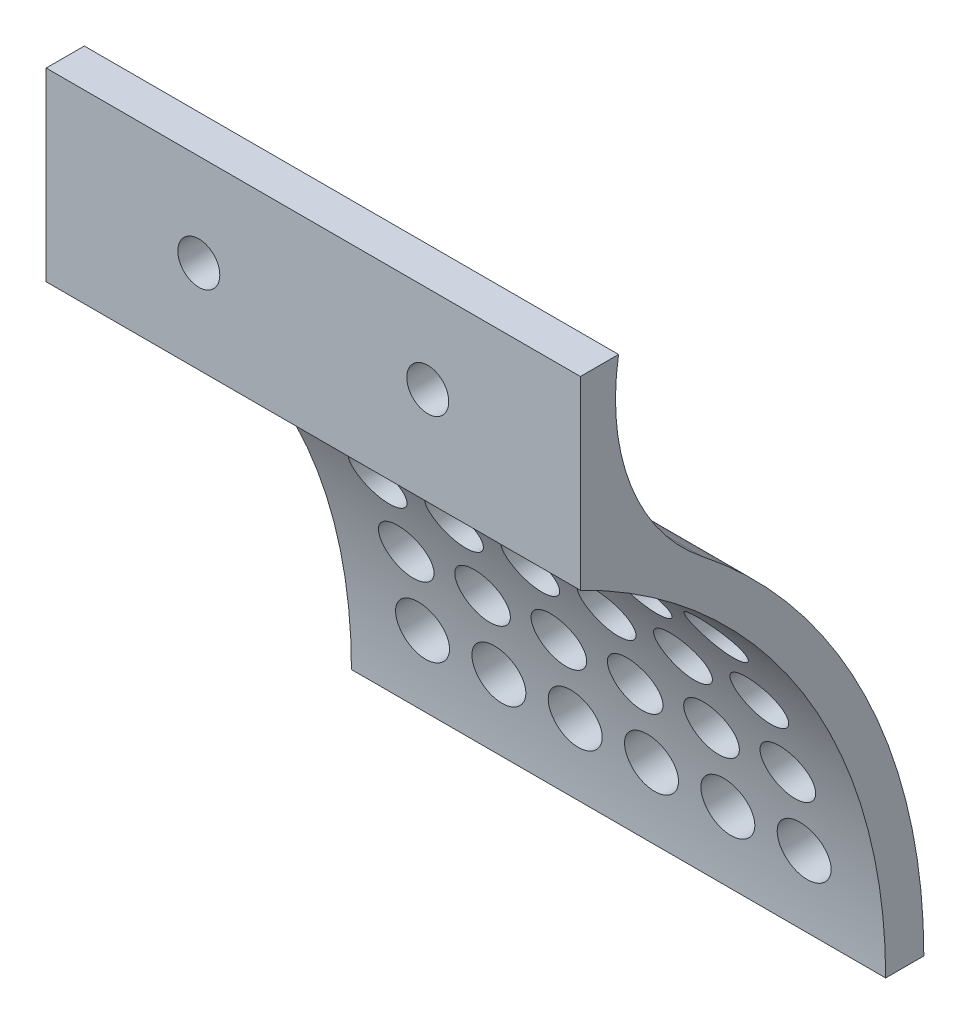
from build123d import *

# Parameters (mm, degrees)
SALIENTE_EXTRUIR1_DEPTH = 70
CROQUIS3_R              = 3.5
CORTAR_EXTRUIR3_DEPTH   = 65
CROQUIS2_R              = 2.750000002
CROQUIS2_R_2            = 2.75
CORTAR_EXTRUIR4_DEPTH   = 65


with BuildPart() as part:
    # Croquis1 → Saliente-Extruir1 (new body)
    with BuildSketch(Plane(origin=(0, 0, 0), x_dir=(0, 0, -1), z_dir=(1, 0, 0))):
        with BuildLine():
            Line((-25.193840863, 53.195024044), (-20.193840863, 53.195024044))
            ThreePointArc((-20.193840863, 53.195024044), (-18.573108699, 37.469004774), (-9.183016609, 24.750489713))
            ThreePointArc((-9.183016609, 24.750489713), (12.176943033, -1.828536951), (19.806159137, -35.062369049))
            Line((19.806159137, -35.062369049), (14.806159137, -35.062369049))
            ThreePointArc((14.806159137, -35.062369049), (3.983638383, 2.673555479), (-25.193840863, 28.937630951))
            Line((-25.193840863, 28.937630951), (-25.193840863, 53.195024044))
        make_face()
    extrude(amount=SALIENTE_EXTRUIR1_DEPTH)

    # Croquis3 → Cortar-Extruir3 (cut)
    with BuildSketch(Plane.XY.offset(-19.806159137)):
        with Locations(Location((60, 14.750489713, 0), (0, 0, 180))):
            Circle(CROQUIS3_R)
        with Locations(Location((50, 14.750489713, 0), (0, 0, 180))):
            Circle(CROQUIS3_R)
        with Locations(Location((40, 14.750489713, 0), (0, 0, 180))):
            Circle(CROQUIS3_R)
        with Locations(Location((30, 14.750489713, 0), (0, 0, 180))):
            Circle(CROQUIS3_R)
        with Locations(Location((20, 14.750489713, 0), (0, 0, 180))):
            Circle(CROQUIS3_R)
        with Locations(Location((10, 14.750489713, 0), (0, 0, 180))):
            Circle(CROQUIS3_R)
        with Locations(Location((50, 4.750489713, 0), (0, 0, 180))):
            Circle(CROQUIS3_R)
        with Locations(Location((40, 4.750489713, 0), (0, 0, 180))):
            Circle(CROQUIS3_R)
        with Locations(Location((30, 4.750489713, 0), (0, 0, 180))):
            Circle(CROQUIS3_R)
        with Locations(Location((20, 4.750489713, 0), (0, 0, 180))):
            Circle(CROQUIS3_R)
        with Locations(Location((10, 4.750489713, 0), (0, 0, 180))):
            Circle(CROQUIS3_R)
        with Locations(Location((50, -5.249510287, 0), (0, 0, 180))):
            Circle(CROQUIS3_R)
        with Locations(Location((40, -5.249510287, 0), (0, 0, 180))):
            Circle(CROQUIS3_R)
        with Locations(Location((30, -5.249510287, 0), (0, 0, 180))):
            Circle(CROQUIS3_R)
        with Locations(Location((20, -5.249510287, 0), (0, 0, 180))):
            Circle(CROQUIS3_R)
        with Locations(Location((10, -5.249510287, 0), (0, 0, 180))):
            Circle(CROQUIS3_R)
        with Locations(Location((60, 4.750489713, 0), (0, 0, 180))):
            Circle(CROQUIS3_R)
        with Locations(Location((60, -5.249510287, 0), (0, 0, 180))):
            Circle(CROQUIS3_R)
        with Locations(Location((20, -15.249510287, 0), (0, 0, 180))):
            Circle(CROQUIS3_R)
        with Locations(Location((30, -15.249510287, 0), (0, 0, 180))):
            Circle(CROQUIS3_R)
        with Locations(Location((40, -15.249510287, 0), (0, 0, 180))):
            Circle(CROQUIS3_R)
        with Locations(Location((50, -15.249510287, 0), (0, 0, 180))):
            Circle(CROQUIS3_R)
        with Locations(Location((60, -15.249510287, 0), (0, 0, 180))):
            Circle(CROQUIS3_R)
        with Locations(Location((20, -25.249510287, 0), (0, 0, 180))):
            Circle(CROQUIS3_R)
        with Locations(Location((30, -25.249510287, 0), (0, 0, 180))):
            Circle(CROQUIS3_R)
        with Locations(Location((40, -25.249510287, 0), (0, 0, 180))):
            Circle(CROQUIS3_R)
        with Locations(Location((50, -25.249510287, 0), (0, 0, 180))):
            Circle(CROQUIS3_R)
        with Locations(Location((60, -25.249510287, 0), (0, 0, 180))):
            Circle(CROQUIS3_R)
        with Locations(Location((10, -15.249510287, 0), (0, 0, 180))):
            Circle(CROQUIS3_R)
        with Locations(Location((10, -25.249510287, 0), (0, 0, 180))):
            Circle(CROQUIS3_R)
    extrude(amount=CORTAR_EXTRUIR3_DEPTH, mode=Mode.SUBTRACT)

    # Croquis2 → Cortar-Extruir4 (cut)
    with BuildSketch(Plane.XY.offset(25.193840863)):
        with Locations((20, 41.066327497)):
            Circle(CROQUIS2_R)
        with Locations((50, 41.717136777)):
            Circle(CROQUIS2_R_2)
    extrude(amount=-CORTAR_EXTRUIR4_DEPTH, mode=Mode.SUBTRACT)


solid = part.part
